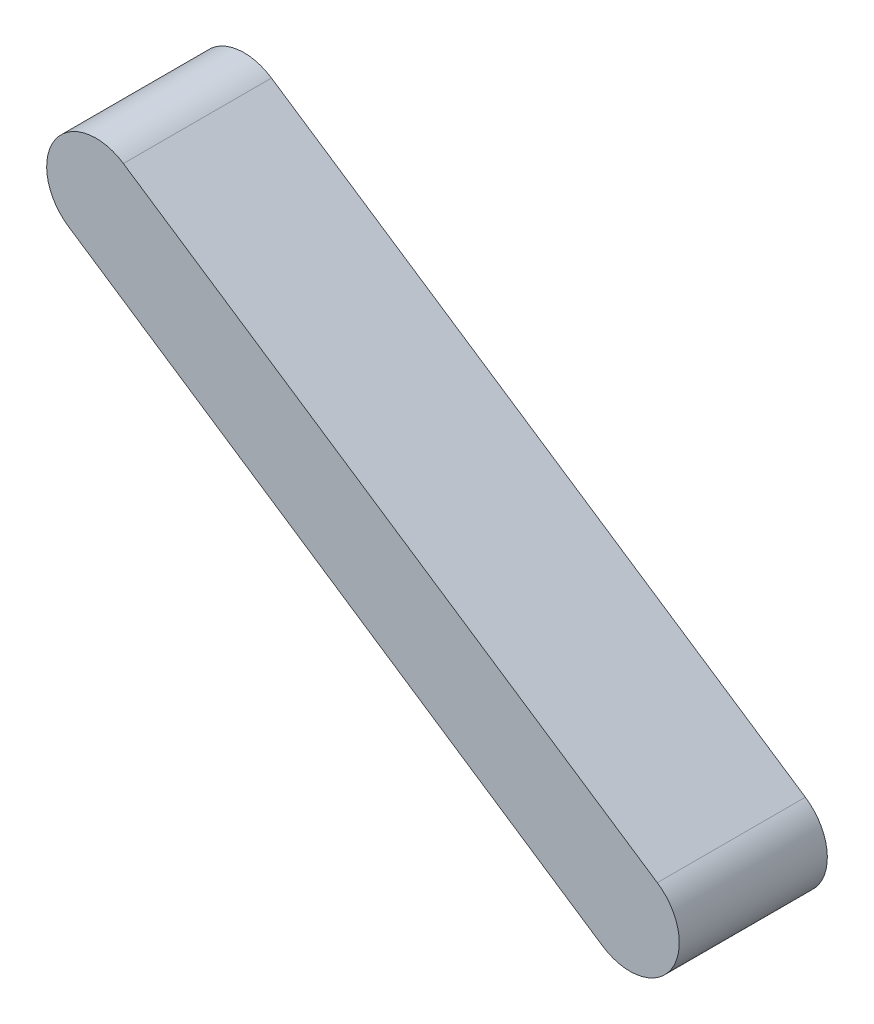
from build123d import *

# Parameters (mm, degrees)
EXTRUDE_1_DEPTH = 15


with BuildPart() as part:
    # 草图2 → 凸台-拉伸1 (new, symmetric)
    with BuildSketch(Plane.XY):
        with BuildLine():
            Line((-5.546347385, -8.320939291), (-113.718558167, 63.781576717))
            ThreePointArc((-113.718558167, 63.781576717), (-116.493150072, 77.648863393), (-102.625863396, 80.423455299))
            Line((-102.625863396, 80.423455299), (5.546347385, 8.320939291))
            ThreePointArc((5.546347385, 8.320939291), (8.320939291, -5.546347385), (-5.546347385, -8.320939291))
        make_face()
    extrude(amount=EXTRUDE_1_DEPTH, both=True)


solid = part.part
